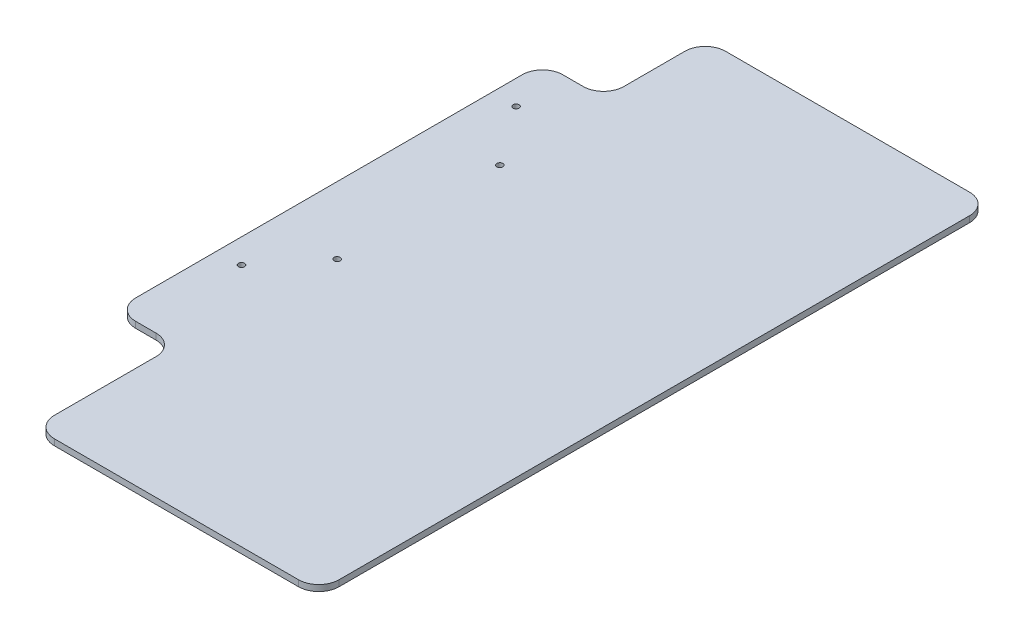
from build123d import *

# Parameters (mm, degrees)
SKETCH_1_W          = 170
SKETCH_1_H          = 220
EXTRUDE_1_DEPTH     = 3
SKETCH_3_R          = 1.5
CUT_EXTRUDE_1_DEPTH = 279.044960393
SKETCH_4_R          = 1.5
CUT_EXTRUDE_2_DEPTH = 279.044960393
SKETCH_5_W          = 170
SKETCH_5_H          = 10
CUT_EXTRUDE_3_DEPTH = 279.044960393
SKETCH_7_W          = 140
SKETCH_7_H          = 50
SKETCH_7_H_2        = 70
EXTRUDE_2_DEPTH     = 3
FILLET_1_R          = 10


with BuildPart() as part:
    # 草图1 → 凸台-拉伸1 (new body)
    with BuildSketch(Plane(origin=(0, 0, 0), x_dir=(1, 0, 0), z_dir=(0, 1, 0))):
        with Locations((85, 110)):
            Rectangle(SKETCH_1_W, SKETCH_1_H)
    extrude(amount=EXTRUDE_1_DEPTH)

    # 草图3 → 切除-拉伸1 (cut, through all)
    with BuildSketch(Plane(origin=(0, 3, 0), x_dir=(1, 0, 0), z_dir=(0, 1, 0))):
        with Locations(Location((33, 86, 0), (0, 0, 270))):
            Circle(SKETCH_3_R)
        with Locations(Location((33, 166, 0), (0, 0, 270))):
            Circle(SKETCH_3_R)
    extrude(amount=-CUT_EXTRUDE_1_DEPTH, mode=Mode.SUBTRACT)

    # 草图4 → 切除-拉伸2 (cut, through all)
    with BuildSketch(Plane(origin=(0, 3, 0), x_dir=(1, 0, 0), z_dir=(0, 1, 0))):
        with Locations(Location((12, 195, 0), (0, 0, 270))):
            Circle(SKETCH_4_R)
        with Locations(Location((12, 60, 0), (0, 0, 270))):
            Circle(SKETCH_4_R)
    extrude(amount=-CUT_EXTRUDE_2_DEPTH, mode=Mode.SUBTRACT)

    # 草图5 → 切除-拉伸3 (cut, through all)
    with BuildSketch(Plane(origin=(0, 3, 0), x_dir=(1, 0, 0), z_dir=(0, 1, 0))):
        with Locations((85, 5)):
            Rectangle(SKETCH_5_W, SKETCH_5_H)
    extrude(amount=-CUT_EXTRUDE_3_DEPTH, mode=Mode.SUBTRACT)

    # 草图7 → 凸台-拉伸2 (add)
    with BuildSketch(Plane(origin=(0, 3, 0), x_dir=(1, 0, 0), z_dir=(0, 1, 0))):
        with Locations((100, 245)):
            Rectangle(SKETCH_7_W, SKETCH_7_H)
        with Locations((100, -25)):
            Rectangle(SKETCH_7_W, SKETCH_7_H_2)
    extrude(amount=-EXTRUDE_2_DEPTH)

    # 圆角1
    fillet_1_edges = [part.edges().sort_by_distance(p)[0] for p in [
        (0, 1.5, -10),
        (30, 1.5, -270),
        (30, 1.5, -220),
        (170, 1.5, -270),
        (30, 1.5, -10),
        (30, 1.5, 60),
        (170, 1.5, 60),
        (0, 1.5, -220),
    ]]
    fillet(fillet_1_edges, radius=FILLET_1_R)


solid = part.part
